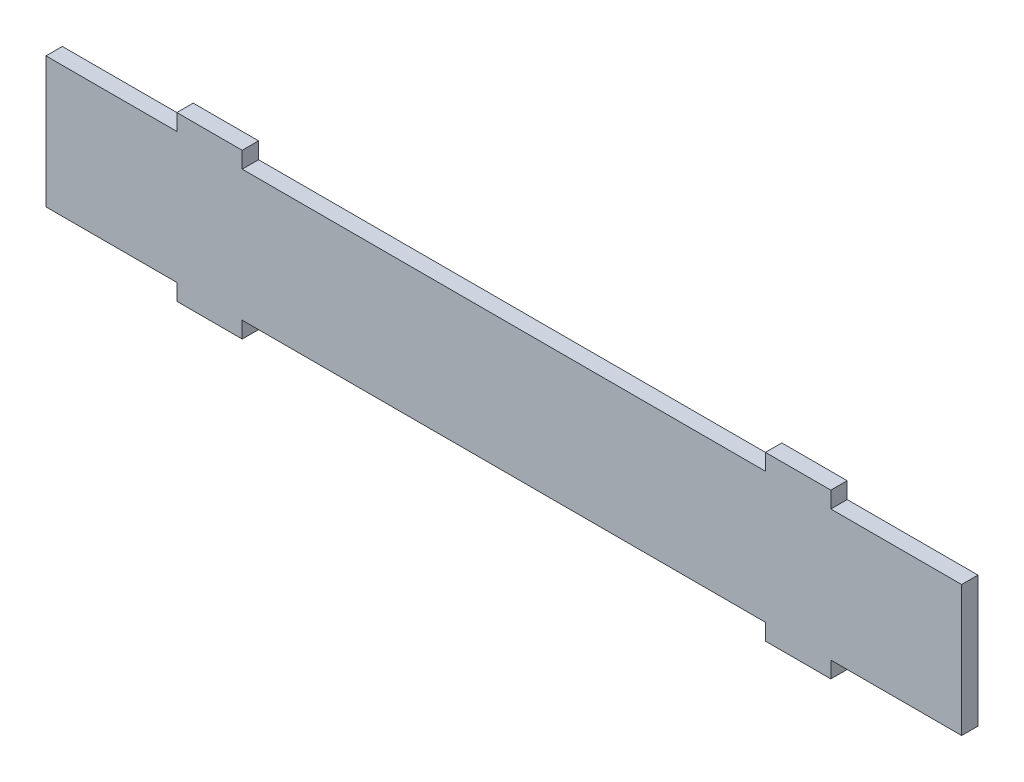
from build123d import *

# Parameters (mm, degrees)
SKETCH1_W           = 177.8
SKETCH1_H           = 25.4
BOSS_EXTRUDE1_DEPTH = 3.175
SKETCH2_W           = 12.7
SKETCH2_H           = 3.175
BOSS_EXTRUDE2_DEPTH = 3.175
SKETCH3_W           = 12.7
SKETCH3_H           = 3.175
BOSS_EXTRUDE3_DEPTH = 3.175


with BuildPart() as part:
    # Sketch1 → Boss-Extrude1 (new body)
    with BuildSketch(Plane.XY):
        with Locations((88.9, 12.7)):
            Rectangle(SKETCH1_W, SKETCH1_H)
    extrude(amount=BOSS_EXTRUDE1_DEPTH)

    # Sketch2 → Boss-Extrude2 (add)
    with BuildSketch(Plane(origin=(0, 25.4, 0), x_dir=(1, 0, 0), z_dir=(0, 1, 0))):
        with Locations((31.75, -1.5875)):
            Rectangle(SKETCH2_W, SKETCH2_H)
        with Locations((146.05, -1.5875)):
            Rectangle(SKETCH2_W, SKETCH2_H)
    extrude(amount=BOSS_EXTRUDE2_DEPTH)

    # Sketch3 → Boss-Extrude3 (add)
    with BuildSketch(Plane.XZ):
        with Locations((31.75, 1.5875)):
            Rectangle(SKETCH3_W, SKETCH3_H)
        with Locations((146.05, 1.5875)):
            Rectangle(SKETCH3_W, SKETCH3_H)
    extrude(amount=BOSS_EXTRUDE3_DEPTH)


solid = part.part
